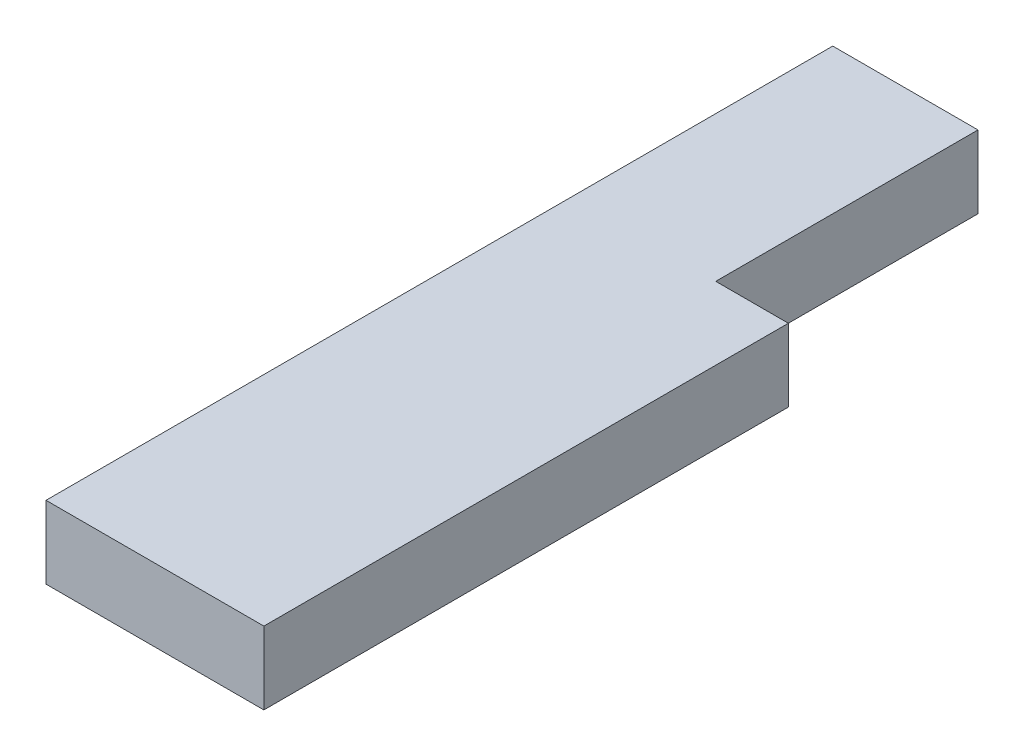
from build123d import *

# Parameters (mm, degrees)
SKETCH1_W           = 54
SKETCH1_H           = 18
BOSS_EXTRUDE1_DEPTH = 130
SKETCH4_W           = 36
SKETCH4_H           = 18
BOSS_EXTRUDE3_DEPTH = 65


with BuildPart() as part:
    # Sketch1 → Boss-Extrude1 (new body)
    with BuildSketch(Plane.XY):
        Rectangle(SKETCH1_W, SKETCH1_H)
    extrude(amount=BOSS_EXTRUDE1_DEPTH)

    # Sketch4 → Boss-Extrude3 (add)
    with BuildSketch(Plane(origin=(0, 0, 0), x_dir=(-1, 0, 0), z_dir=(0, 0, -1))):
        with Locations((9, 0)):
            Rectangle(SKETCH4_W, SKETCH4_H)
    extrude(amount=BOSS_EXTRUDE3_DEPTH)


solid = part.part
